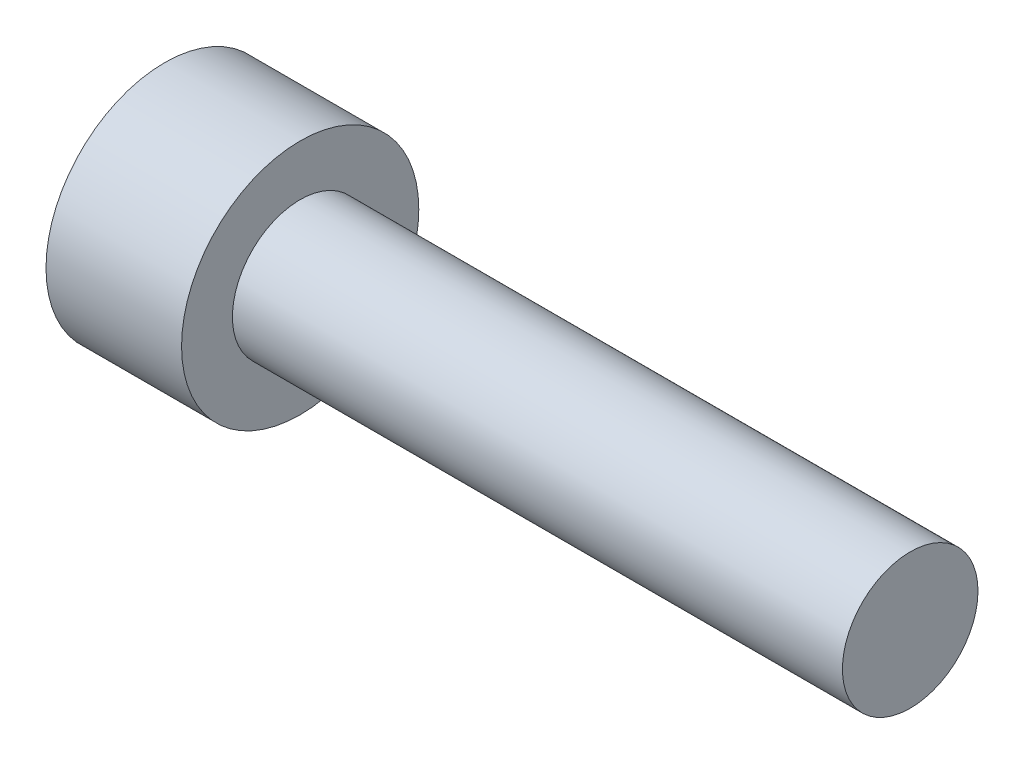
from build123d import *

# Parameters (mm, degrees)
SKETCH_1_R          = 3.5
EXTRUDE_1_DEPTH     = 4
CUT_EXTRUDE_1_DEPTH = 2
SKETCH_3_R          = 2
EXTRUDE_2_DEPTH     = 18


with BuildPart() as part:
    # 草图1 → 凸台-拉伸1 (new body)
    with BuildSketch(Plane(origin=(0, 0, 0), x_dir=(0, 0, -1), z_dir=(1, 0, 0))):
        Circle(SKETCH_1_R)
    extrude(amount=EXTRUDE_1_DEPTH)

    # 草图2 → 切除-拉伸1 (cut)
    with BuildSketch(Plane.ZY):
        Polygon((1.525, -0.880459161), (1.525, 0.880459161), (0, 1.760918321), (-1.525, 0.880459161), (-1.525, -0.880459161), (0, -1.760918321), align=None)
    extrude(amount=-CUT_EXTRUDE_1_DEPTH, mode=Mode.SUBTRACT)

    # 草图3 → 凸台-拉伸2 (add)
    with BuildSketch(Plane(origin=(4, 0, 0), x_dir=(0, 0, -1), z_dir=(1, 0, 0))):
        Circle(SKETCH_3_R)
    extrude(amount=EXTRUDE_2_DEPTH)


solid = part.part
